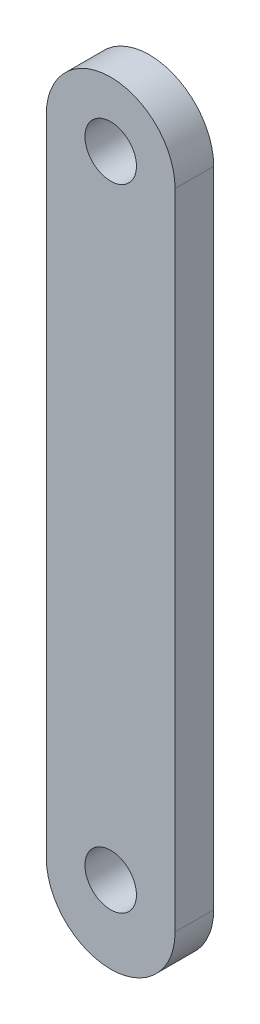
from build123d import *

# Parameters (mm, degrees)
SKETCH1_R           = 2
BOSS_EXTRUDE1_DEPTH = 3


with BuildPart() as part:
    # Sketch1 → Boss-Extrude1 (new body)
    with BuildSketch(Plane.XY):
        with BuildLine():
            Line((5, 25), (5, -25))
            ThreePointArc((5, -25), (0, -30), (-5, -25))
            Line((-5, -25), (-5, 25))
            ThreePointArc((-5, 25), (0, 30), (5, 25))
        make_face()
        with Locations((0, 25)):
            Circle(SKETCH1_R, mode=Mode.SUBTRACT)
        with Locations((0, -24)):
            Circle(SKETCH1_R, mode=Mode.SUBTRACT)
    extrude(amount=BOSS_EXTRUDE1_DEPTH)


solid = part.part
